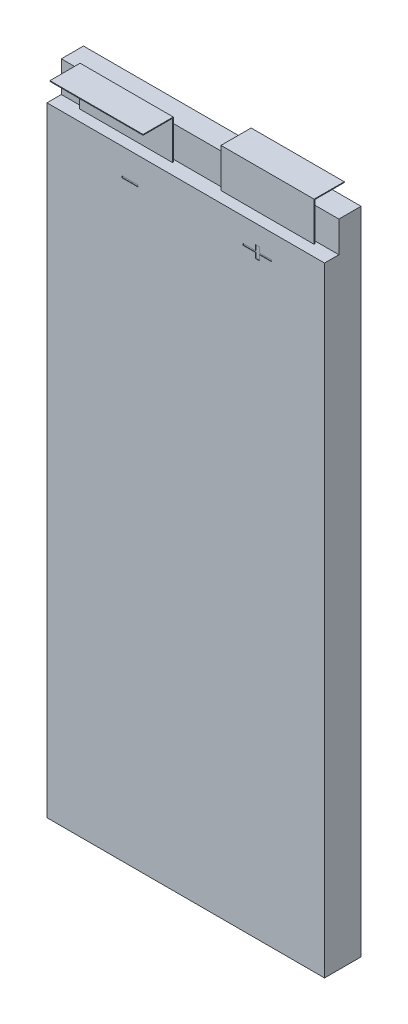
from build123d import *

# Parameters (mm, degrees)
SKETCH_1_W          = 74.5
SKETCH_1_H          = 166.2
EXTRUDE_1_DEPTH     = 4.9
SKETCH_3_W          = 74.5
SKETCH_3_H          = 5.95
EXTRUDE_2_DEPTH     = 8.3
SKETCH_4_W          = 25
SKETCH_4_H          = 0.2
EXTRUDE_4_DEPTH     = 10.5
SKETCH_6_W          = 25
SKETCH_6_H          = 0.2
EXTRUDE_5_DEPTH     = 7.9
SKETCH_7_W          = 25
SKETCH_7_H          = 0.2
EXTRUDE_6_DEPTH     = 7.9
SKETCH_8_W          = 4.335096154
SKETCH_8_H          = 0.488461538
CUT_EXTRUDE_1_DEPTH = 0.1


with BuildPart() as part:
    # 草图1 → 凸台-拉伸1 (new, symmetric)
    with BuildSketch(Plane.XY):
        Rectangle(SKETCH_1_W, SKETCH_1_H)
    extrude(amount=EXTRUDE_1_DEPTH, both=True)

    # 草图3 → 凸台-拉伸2 (add)
    with BuildSketch(Plane(origin=(0, 83.1, 0), x_dir=(1, 0, 0), z_dir=(0, 1, 0))):
        with Locations((0, 1.925)):
            Rectangle(SKETCH_3_W, SKETCH_3_H)
    extrude(amount=EXTRUDE_2_DEPTH)

    # 草图4 → 凸台-拉伸4 (add)
    with BuildSketch(Plane(origin=(0, 83.1, 0), x_dir=(1, 0, 0), z_dir=(0, 1, 0))):
        with Locations((-19, -1.85)):
            Rectangle(SKETCH_4_W, SKETCH_4_H)
        with Locations((19, -1.85)):
            Rectangle(SKETCH_4_W, SKETCH_4_H)
    extrude(amount=EXTRUDE_4_DEPTH)

    # 草图6 → 凸台-拉伸5 (add)
    with BuildSketch(Plane.XY.offset(1.95)):
        with Locations((-19, 93.5)):
            Rectangle(SKETCH_6_W, SKETCH_6_H)
    extrude(amount=EXTRUDE_5_DEPTH)

    # 草图7 → 凸台-拉伸6 (add)
    with BuildSketch(Plane(origin=(0, 0, 1.75), x_dir=(-1, 0, 0), z_dir=(0, 0, -1))):
        with Locations((-19, 93.5)):
            Rectangle(SKETCH_7_W, SKETCH_7_H)
    extrude(amount=EXTRUDE_6_DEPTH)

    # 草图8 → 切除-拉伸1 (cut)
    with BuildSketch(Plane(origin=(0, 0, -4.9), x_dir=(-1, 0, 0), z_dir=(0, 0, -1))):
        Polygon((-19.751628191, 76.72094721), (-19.751628191, 78.125274133), (-18.713647422, 78.125274133), (-18.713647422, 76.72094721), (-15.416532037, 76.72094721), (-15.416532037, 76.293543364), (-18.713647422, 76.293543364), (-18.713647422, 74.889216441), (-19.751628191, 74.889216441), (-19.751628191, 76.293543364), (-23.048743575, 76.293543364), (-23.048743575, 76.72094721), align=None)
        with Locations((14.959669886, 75.988254902)):
            Rectangle(SKETCH_8_W, SKETCH_8_H)
    cut_extrude_1 = extrude(amount=-CUT_EXTRUDE_1_DEPTH, mode=Mode.SUBTRACT)

    # 镜向1: 切除-拉伸1 across plane
    add(cut_extrude_1.mirror(Plane.XY), mode=Mode.SUBTRACT)


solid = part.part
